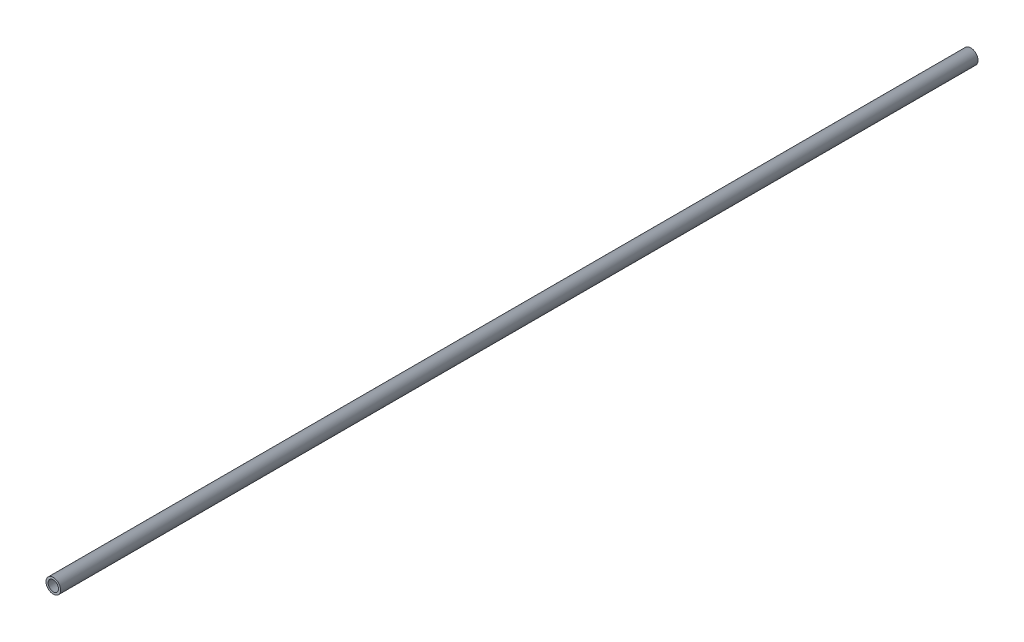
from build123d import *

# Parameters (mm, degrees)
DEFINED_MATERIAL_SECTION_L220_DEPTH = 220


with BuildPart() as part:
    # Sketch1 → Defined_Material_Section_L220 (new body)
    with BuildSketch(Plane.XY):
        Polygon((11.248650813, -0.068704678), (11.244605334, -0.137303418), (11.2378698, -0.205690446), (11.228454596, -0.273760314), (11.216374241, -0.341408064), (11.201647361, -0.408529387), (11.184296664, -0.475020787), (11.164348904, -0.54077974), (11.141834838, -0.60570485), (11.116789182, -0.669696007), (11.089250554, -0.732654541), (11.059261417, -0.794483375), (11.026868012, -0.855087173), (10.992120288, -0.914372488), (10.955071822, -0.972247908), (10.91577974, -1.028624192), (10.874304629, -1.083414411), (10.83071044, -1.136534085), (10.785064392, -1.187901305), (10.737436867, -1.237436867), (10.687901305, -1.285064392), (10.636534085, -1.33071044), (10.583414411, -1.374304629), (10.528624192, -1.41577974), (10.472247908, -1.455071822), (10.414372488, -1.492120288), (10.355087173, -1.526868012), (10.294483375, -1.559261417), (10.232654541, -1.589250554), (10.169696007, -1.616789182), (10.10570485, -1.641834838), (10.04077974, -1.664348904), (9.975020787, -1.684296664), (9.908529387, -1.701647361), (9.841408064, -1.716374241), (9.773760314, -1.728454596), (9.705690446, -1.7378698), (9.637303418, -1.744605334), (9.568704678, -1.748650813), (9.5, -1.75), (9.431295322, -1.748650813), (9.362696582, -1.744605334), (9.294309554, -1.7378698), (9.226239686, -1.728454596), (9.158591936, -1.716374241), (9.091470613, -1.701647361), (9.024979213, -1.684296664), (8.95922026, -1.664348904), (8.89429515, -1.641834838), (8.830303993, -1.616789182), (8.767345459, -1.589250554), (8.705516625, -1.559261417), (8.644912827, -1.526868012), (8.585627512, -1.492120288), (8.527752092, -1.455071822), (8.471375808, -1.41577974), (8.416585589, -1.374304629), (8.363465915, -1.33071044), (8.312098695, -1.285064392), (8.262563133, -1.237436867), (8.214935608, -1.187901305), (8.16928956, -1.136534085), (8.125695371, -1.083414411), (8.08422026, -1.028624192), (8.044928178, -0.972247908), (8.007879712, -0.914372488), (7.973131988, -0.855087173), (7.940738583, -0.794483375), (7.910749446, -0.732654541), (7.883210818, -0.669696007), (7.858165162, -0.60570485), (7.835651096, -0.54077974), (7.815703336, -0.475020787), (7.798352639, -0.408529387), (7.783625759, -0.341408064), (7.771545404, -0.273760314), (7.7621302, -0.205690446), (7.755394666, -0.137303418), (7.751349187, -0.068704678), (7.75, 0), (7.751349187, 0.068704678), (7.755394666, 0.137303418), (7.7621302, 0.205690446), (7.771545404, 0.273760314), (7.783625759, 0.341408064), (7.798352639, 0.408529387), (7.815703336, 0.475020787), (7.835651096, 0.54077974), (7.858165162, 0.60570485), (7.883210818, 0.669696007), (7.910749446, 0.732654541), (7.940738583, 0.794483375), (7.973131988, 0.855087173), (8.007879712, 0.914372488), (8.044928178, 0.972247908), (8.08422026, 1.028624192), (8.125695371, 1.083414411), (8.16928956, 1.136534085), (8.214935608, 1.187901305), (8.262563133, 1.237436867), (8.312098695, 1.285064392), (8.363465915, 1.33071044), (8.416585589, 1.374304629), (8.471375808, 1.41577974), (8.527752092, 1.455071822), (8.585627512, 1.492120288), (8.644912827, 1.526868012), (8.705516625, 1.559261417), (8.767345459, 1.589250554), (8.830303993, 1.616789182), (8.89429515, 1.641834838), (8.95922026, 1.664348904), (9.024979213, 1.684296664), (9.091470613, 1.701647361), (9.158591936, 1.716374241), (9.226239686, 1.728454596), (9.294309554, 1.7378698), (9.362696582, 1.744605334), (9.431295322, 1.748650813), (9.5, 1.75), (9.568704678, 1.748650813), (9.637303418, 1.744605334), (9.705690446, 1.7378698), (9.773760314, 1.728454596), (9.841408064, 1.716374241), (9.908529387, 1.701647361), (9.975020787, 1.684296664), (10.04077974, 1.664348904), (10.10570485, 1.641834838), (10.169696007, 1.616789182), (10.232654541, 1.589250554), (10.294483375, 1.559261417), (10.355087173, 1.526868012), (10.414372488, 1.492120288), (10.472247908, 1.455071822), (10.528624192, 1.41577974), (10.583414411, 1.374304629), (10.636534085, 1.33071044), (10.687901305, 1.285064392), (10.737436867, 1.237436867), (10.785064392, 1.187901305), (10.83071044, 1.136534085), (10.874304629, 1.083414411), (10.91577974, 1.028624192), (10.955071822, 0.972247908), (10.992120288, 0.914372488), (11.026868012, 0.855087173), (11.059261417, 0.794483375), (11.089250554, 0.732654541), (11.116789182, 0.669696007), (11.141834838, 0.60570485), (11.164348904, 0.54077974), (11.184296664, 0.475020787), (11.201647361, 0.408529387), (11.216374241, 0.341408064), (11.228454596, 0.273760314), (11.2378698, 0.205690446), (11.244605334, 0.137303418), (11.248650813, 0.068704678), (11.25, 0), align=None)
        Polygon((10.749036295, 0.04907477), (10.746146667, 0.09807387), (10.741335571, 0.146921747), (10.734610426, 0.195543081), (10.725981601, 0.243862903), (10.7154624, 0.291806705), (10.703069046, 0.339300562), (10.688820645, 0.386271243), (10.67273917, 0.432646321), (10.654849416, 0.47835429), (10.635178967, 0.523324672), (10.613758155, 0.567488125), (10.590620009, 0.610776552), (10.565800205, 0.653123206), (10.539337015, 0.694462791), (10.511271243, 0.734731565), (10.481646164, 0.773867437), (10.450507457, 0.81181006), (10.417903137, 0.848500932), (10.383883476, 0.883883476), (10.348500932, 0.917903137), (10.31181006, 0.950507457), (10.273867437, 0.981646164), (10.234731565, 1.011271243), (10.194462791, 1.039337015), (10.153123206, 1.065800205), (10.110776552, 1.090620009), (10.067488125, 1.113758155), (10.023324672, 1.135178967), (9.97835429, 1.154849416), (9.932646321, 1.17273917), (9.886271243, 1.188820645), (9.839300562, 1.203069046), (9.791806705, 1.2154624), (9.743862903, 1.225981601), (9.695543081, 1.234610426), (9.646921747, 1.241335571), (9.59807387, 1.246146667), (9.54907477, 1.249036295), (9.5, 1.25), (9.45092523, 1.249036295), (9.40192613, 1.246146667), (9.353078253, 1.241335571), (9.304456919, 1.234610426), (9.256137097, 1.225981601), (9.208193295, 1.2154624), (9.160699438, 1.203069046), (9.113728757, 1.188820645), (9.067353679, 1.17273917), (9.02164571, 1.154849416), (8.976675328, 1.135178967), (8.932511875, 1.113758155), (8.889223448, 1.090620009), (8.846876794, 1.065800205), (8.805537209, 1.039337015), (8.765268435, 1.011271243), (8.726132563, 0.981646164), (8.68818994, 0.950507457), (8.651499068, 0.917903137), (8.616116524, 0.883883476), (8.582096863, 0.848500932), (8.549492543, 0.81181006), (8.518353836, 0.773867437), (8.488728757, 0.734731565), (8.460662985, 0.694462791), (8.434199795, 0.653123206), (8.409379991, 0.610776552), (8.386241845, 0.567488125), (8.364821033, 0.523324672), (8.345150584, 0.47835429), (8.32726083, 0.432646321), (8.311179355, 0.386271243), (8.296930954, 0.339300562), (8.2845376, 0.291806705), (8.274018399, 0.243862903), (8.265389574, 0.195543081), (8.258664429, 0.146921747), (8.253853333, 0.09807387), (8.250963705, 0.04907477), (8.25, 0), (8.250963705, -0.04907477), (8.253853333, -0.09807387), (8.258664429, -0.146921747), (8.265389574, -0.195543081), (8.274018399, -0.243862903), (8.2845376, -0.291806705), (8.296930954, -0.339300562), (8.311179355, -0.386271243), (8.32726083, -0.432646321), (8.345150584, -0.47835429), (8.364821033, -0.523324672), (8.386241845, -0.567488125), (8.409379991, -0.610776552), (8.434199795, -0.653123206), (8.460662985, -0.694462791), (8.488728757, -0.734731565), (8.518353836, -0.773867437), (8.549492543, -0.81181006), (8.582096863, -0.848500932), (8.616116524, -0.883883476), (8.651499068, -0.917903137), (8.68818994, -0.950507457), (8.726132563, -0.981646164), (8.765268435, -1.011271243), (8.805537209, -1.039337015), (8.846876794, -1.065800205), (8.889223448, -1.090620009), (8.932511875, -1.113758155), (8.976675328, -1.135178967), (9.02164571, -1.154849416), (9.067353679, -1.17273917), (9.113728757, -1.188820645), (9.160699438, -1.203069046), (9.208193295, -1.2154624), (9.256137097, -1.225981601), (9.304456919, -1.234610426), (9.353078253, -1.241335571), (9.40192613, -1.246146667), (9.45092523, -1.249036295), (9.5, -1.25), (9.54907477, -1.249036295), (9.59807387, -1.246146667), (9.646921747, -1.241335571), (9.695543081, -1.234610426), (9.743862903, -1.225981601), (9.791806705, -1.2154624), (9.839300562, -1.203069046), (9.886271243, -1.188820645), (9.932646321, -1.17273917), (9.97835429, -1.154849416), (10.023324672, -1.135178967), (10.067488125, -1.113758155), (10.110776552, -1.090620009), (10.153123206, -1.065800205), (10.194462791, -1.039337015), (10.234731565, -1.011271243), (10.273867437, -0.981646164), (10.31181006, -0.950507457), (10.348500932, -0.917903137), (10.383883476, -0.883883476), (10.417903137, -0.848500932), (10.450507457, -0.81181006), (10.481646164, -0.773867437), (10.511271243, -0.734731565), (10.539337015, -0.694462791), (10.565800205, -0.653123206), (10.590620009, -0.610776552), (10.613758155, -0.567488125), (10.635178967, -0.523324672), (10.654849416, -0.47835429), (10.67273917, -0.432646321), (10.688820645, -0.386271243), (10.703069046, -0.339300562), (10.7154624, -0.291806705), (10.725981601, -0.243862903), (10.734610426, -0.195543081), (10.741335571, -0.146921747), (10.746146667, -0.09807387), (10.749036295, -0.04907477), (10.75, 0), align=None, mode=Mode.SUBTRACT)
    extrude(amount=DEFINED_MATERIAL_SECTION_L220_DEPTH)


solid = part.part
